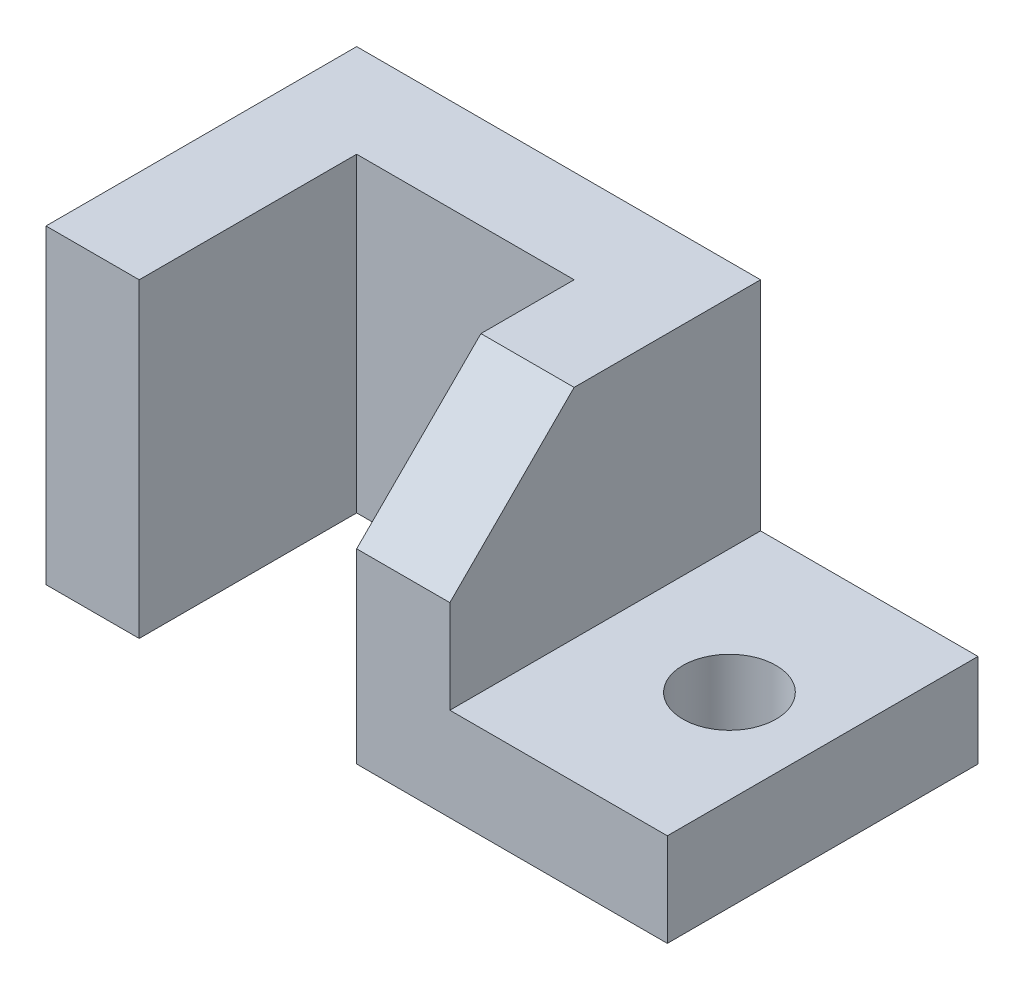
from build123d import *

# Parameters (mm, degrees)
BOSS_EXTRUDE1_DEPTH = 63.5
BOSS_EXTRUDE2_DEPTH = 63.5
SKETCH3_R           = 9.525
CUT_EXTRUDE1_DEPTH  = 101.201309872
CUT_EXTRUDE2_REACH  = 123.98


with BuildPart() as part:
    # Sketch1 → Boss-Extrude1 (new body)
    with BuildSketch(Plane.XY):
        Polygon((0, 63.5), (19.05, 63.5), (19.05, 19.05), (63.5, 19.05), (63.5, 0), (0, 0), align=None)
    extrude(amount=BOSS_EXTRUDE1_DEPTH)

    # Sketch2 → Boss-Extrude2 (add)
    with BuildSketch(Plane(origin=(0, 63.5, 0), x_dir=(1, 0, 0), z_dir=(0, 1, 0))):
        Polygon((0, 0), (-63.5, 0), (-63.5, -63.5), (-44.45, -63.5), (-44.45, -19.05), (0, -19.05), align=None)
    extrude(amount=-BOSS_EXTRUDE2_DEPTH)

    # Sketch3 → Cut-Extrude1 (cut, through all)
    with BuildSketch(Plane(origin=(0, 19.05, 0), x_dir=(1, 0, 0), z_dir=(0, 1, 0))):
        with Locations(Location((44.45, -31.75, 0), (0, 0, 180))):
            Circle(SKETCH3_R)
    extrude(amount=-CUT_EXTRUDE1_DEPTH, mode=Mode.SUBTRACT)

    # Sketch4 → Cut-Extrude2 (cut, up to next)
    with BuildSketch(Plane(origin=(19.05, 0, 0), x_dir=(0, 0, -1), z_dir=(1, 0, 0)), mode=Mode.PRIVATE) as cut_extrude2_sk1:
        Polygon((-63.5, 63.5), (-38.1, 63.5), (-63.5, 38.1), align=None)
    cut_extrude2_tool1 = extrude(cut_extrude2_sk1.sketch, amount=-CUT_EXTRUDE2_REACH, mode=Mode.PRIVATE) & part.part
    add(cut_extrude2_tool1.solids().sort_by_distance((19.05, 55.033333, 55.033333))[0], mode=Mode.SUBTRACT)


solid = part.part
